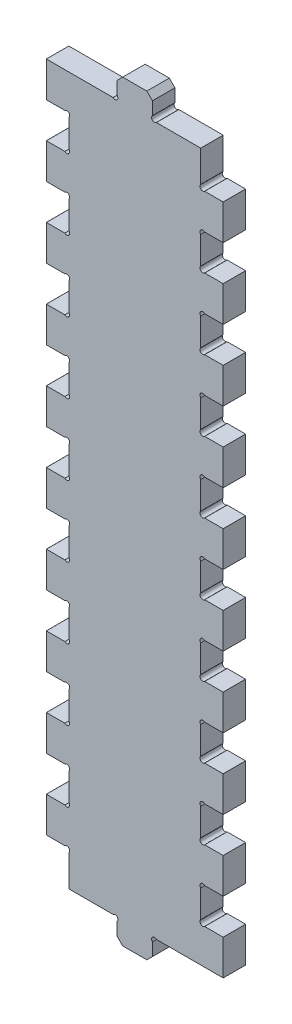
from build123d import *

# Parameters (mm, degrees)
SKETCH1_W           = 50.000000076
SKETCH1_H           = 200.000108
BOSS_EXTRUDE1_DEPTH = 6.35
SKETCH2_W           = 10.0000054
SKETCH2_H           = 6.35
BOSS_EXTRUDE2_DEPTH = 6.35
SKETCH8_W           = 6.35
SKETCH8_H           = 10.0000054
CUT_EXTRUDE6_DEPTH  = 213.416311942
LPATTERN4_COUNT     = 10
LPATTERN4_PITCH     = 20.0000108
SKETCH9_R           = 0.79375
CUT_EXTRUDE7_DEPTH  = 213.416311942
LPATTERN5_COUNT     = 9
LPATTERN5_PITCH     = 20.0000108
SKETCH10_R          = 0.79375
CUT_EXTRUDE8_DEPTH  = 213.416311942
CHAMFER1_SIZE       = 1.5875
SKETCH11_R          = 0.79375
CUT_EXTRUDE10_DEPTH = 213.416311942
SKETCH14_W          = 6.3240118
SKETCH14_H          = 10.0254054
CUT_EXTRUDE13_DEPTH = 213.416311942
LPATTERN7_COUNT     = 10
LPATTERN7_PITCH     = 20.0000108


with BuildPart() as part:
    # Sketch1 → Boss-Extrude1 (new body)
    with BuildSketch(Plane.XY):
        with Locations((25.000000038, 100.000054)):
            Rectangle(SKETCH1_W, SKETCH1_H)
    extrude(amount=BOSS_EXTRUDE1_DEPTH)

    # Sketch2 → Boss-Extrude2 (add)
    with BuildSketch(Plane.XY):
        with Locations((25.000000038, 203.175108)):
            Rectangle(SKETCH2_W, SKETCH2_H)
        with Locations((25.000000038, -3.175)):
            Rectangle(SKETCH2_W, SKETCH2_H)
    extrude(amount=BOSS_EXTRUDE2_DEPTH)

    # Sketch8 → Cut-Extrude6 (cut, through all)
    with BuildSketch(Plane.XY.offset(6.35)):
        with Locations((3.175, 5.0000027)):
            Rectangle(SKETCH8_W, SKETCH8_H)
        with Locations((46.825000076, 15.0000081)):
            Rectangle(SKETCH8_W, SKETCH8_H)
    cut_extrude6 = extrude(amount=-CUT_EXTRUDE6_DEPTH, mode=Mode.SUBTRACT)

    # LPattern4: Cut-Extrude6 ×10
    with Locations(*[(0, i * LPATTERN4_PITCH, 0) for i in range(1, LPATTERN4_COUNT)]):
        add(cut_extrude6, mode=Mode.SUBTRACT)

    # Sketch9 → Cut-Extrude7 (cut, through all)
    with BuildSketch(Plane.XY.offset(6.35)):
        with Locations((5.788733992, 29.438750192)):
            Circle(SKETCH9_R)
        with Locations((5.788733992, 20.561276808)):
            Circle(SKETCH9_R)
        with Locations((44.211266084, 19.438744792)):
            Circle(SKETCH9_R)
        with Locations((44.211266084, 10.561271408)):
            Circle(SKETCH9_R)
    cut_extrude7 = extrude(amount=-CUT_EXTRUDE7_DEPTH, mode=Mode.SUBTRACT)

    # LPattern5: Cut-Extrude7 ×9
    with Locations(*[(0, i * LPATTERN5_PITCH, 0) for i in range(1, LPATTERN5_COUNT)]):
        add(cut_extrude7, mode=Mode.SUBTRACT)

    # Sketch10 → Cut-Extrude8 (cut, through all)
    with BuildSketch(Plane.XY.offset(6.35)):
        with Locations((5.788733992, 9.438739392)):
            Circle(SKETCH10_R)
        with Locations((44.211266084, 190.561368608)):
            Circle(SKETCH10_R)
    extrude(amount=-CUT_EXTRUDE8_DEPTH, mode=Mode.SUBTRACT)

    # Chamfer1
    chamfer1_edges = [part.edges().sort_by_distance(p)[0] for p in [
        (30.000002738, 206.350108, 3.175),
        (19.999997338, 206.350108, 3.175),
        (19.999997338, -6.35, 3.175),
        (30.000002738, -6.35, 3.175),
    ]]
    chamfer(chamfer1_edges, length=CHAMFER1_SIZE)

    # Sketch11 → Cut-Extrude10 (cut, through all)
    with BuildSketch(Plane.XY):
        with Locations((19.43873133, 200.561374008)):
            Circle(SKETCH11_R)
        with Locations((30.561268746, 200.561374008)):
            Circle(SKETCH11_R)
        with Locations((19.43873133, -0.561266008)):
            Circle(SKETCH11_R)
        with Locations((30.561268746, -0.561266008)):
            Circle(SKETCH11_R)
    extrude(amount=CUT_EXTRUDE10_DEPTH, mode=Mode.SUBTRACT)

    # Sketch14 → Cut-Extrude13 (cut, through all)
    with BuildSketch(Plane.XY.offset(6.35)):
        with Locations((3.175, 5.0000027)):
            Rectangle(SKETCH14_W, SKETCH14_H)
        with Locations((46.825000076, 15.0000081)):
            Rectangle(SKETCH14_W, SKETCH14_H)
    cut_extrude13 = extrude(amount=-CUT_EXTRUDE13_DEPTH, mode=Mode.SUBTRACT)

    # LPattern7: Cut-Extrude13 ×10
    with Locations(*[(0, i * LPATTERN7_PITCH, 0) for i in range(1, LPATTERN7_COUNT)]):
        add(cut_extrude13, mode=Mode.SUBTRACT)


solid = part.part
